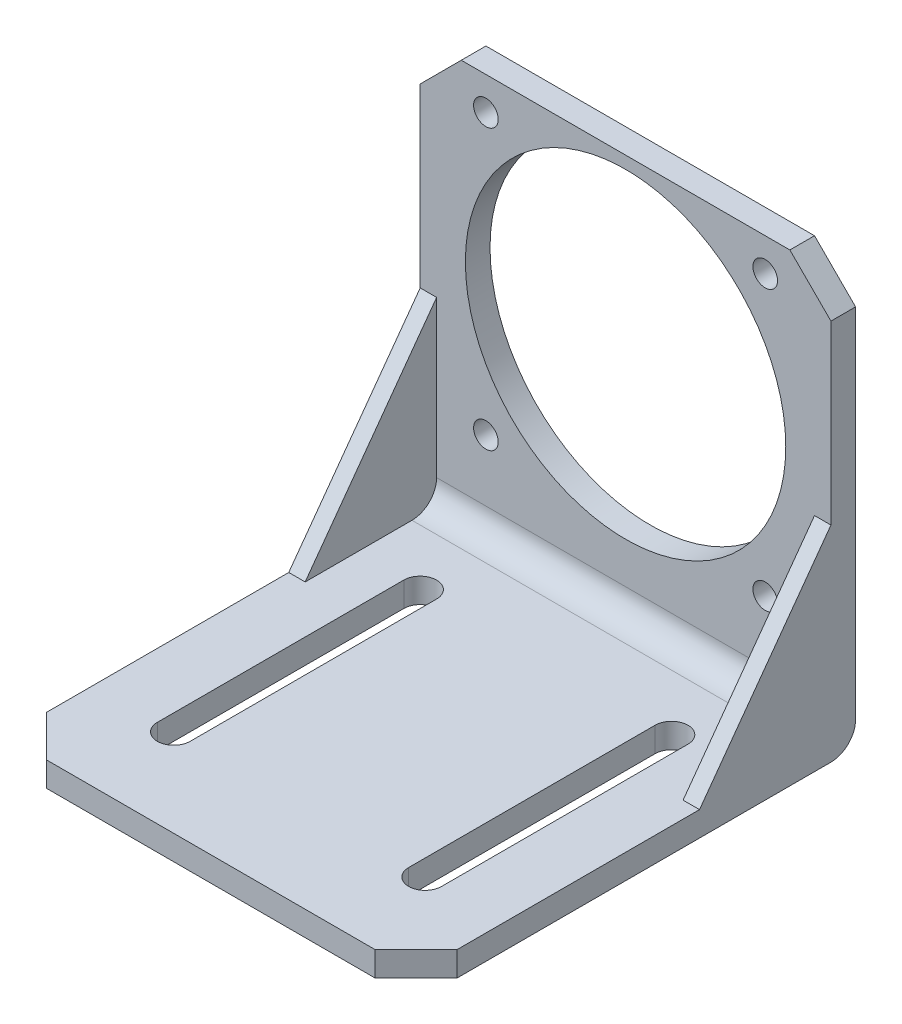
from build123d import *

# Parameters (mm, degrees)
SKETCH_1_R      = 1.5
SKETCH_1_R_2    = 19.5
EXTRUDE_1_DEPTH = 3
EXTRUDE_3_DEPTH = 3
EXTRUDE_4_DEPTH = 2
FILLET_2_R      = 3


with BuildPart() as part:
    # 草图1 → 凸台-拉伸1 (new body)
    with BuildSketch(Plane.XY):
        Polygon((20, 25.75), (-20, 25.75), (-25, 20.75), (-25, -25.75), (25, -25.75), (25, 20.75), align=None)
        with Locations((-17, -12.25)):
            Circle(SKETCH_1_R, mode=Mode.SUBTRACT)
        with Locations((17, -12.25)):
            Circle(SKETCH_1_R, mode=Mode.SUBTRACT)
        with Locations((-17, 21.75)):
            Circle(SKETCH_1_R, mode=Mode.SUBTRACT)
        with Locations((0, 4.75)):
            Circle(SKETCH_1_R_2, mode=Mode.SUBTRACT)
        with Locations((17, 21.75)):
            Circle(SKETCH_1_R, mode=Mode.SUBTRACT)
    extrude(amount=EXTRUDE_1_DEPTH)

    # 草图2 → 凸台-拉伸3 (add)
    with BuildSketch(Plane.XZ.offset(25.75)):
        Polygon((-25, 48.5), (-25, 0), (25, 0), (25, 48.5), (20, 53.5), (-20, 53.5), align=None)
        with BuildLine():
            ThreePointArc((-13.2, 12.8), (-15.2, 10.8), (-17.2, 12.8))
            Line((-17.2, 12.8), (-17.2, 42.8))
            ThreePointArc((-17.2, 42.8), (-15.2, 44.8), (-13.2, 42.8))
            Line((-13.2, 42.8), (-13.2, 12.8))
        make_face(mode=Mode.SUBTRACT)
        with BuildLine():
            ThreePointArc((17.4, 12.8), (15.4, 10.8), (13.4, 12.8))
            Line((13.4, 12.8), (13.4, 42.8))
            ThreePointArc((13.4, 42.8), (15.4, 44.8), (17.4, 42.8))
            Line((17.4, 42.8), (17.4, 12.8))
        make_face(mode=Mode.SUBTRACT)
    extrude(amount=-EXTRUDE_3_DEPTH)

    # 草图3 → 凸台-拉伸4 (add)
    with BuildSketch(Plane(origin=(25, 0, 0), x_dir=(0, 0, -1), z_dir=(1, 0, 0))):
        Polygon((-3, -0.75), (-3, -22.75), (-19, -22.75), align=None)
    extrude_4 = extrude(amount=-EXTRUDE_4_DEPTH)

    # 镜向1: 凸台-拉伸4 across plane
    add(extrude_4.mirror(Plane(origin=(0, 0, 0), x_dir=(0, 0, 1), z_dir=(1, 0, 0))))

    # 圆角2
    fillet_2_edges = [part.edges().sort_by_distance(p)[0] for p in [
        (0, -25.75, 0),
        (0, -22.75, 3),
    ]]
    fillet(fillet_2_edges, radius=FILLET_2_R)


solid = part.part
